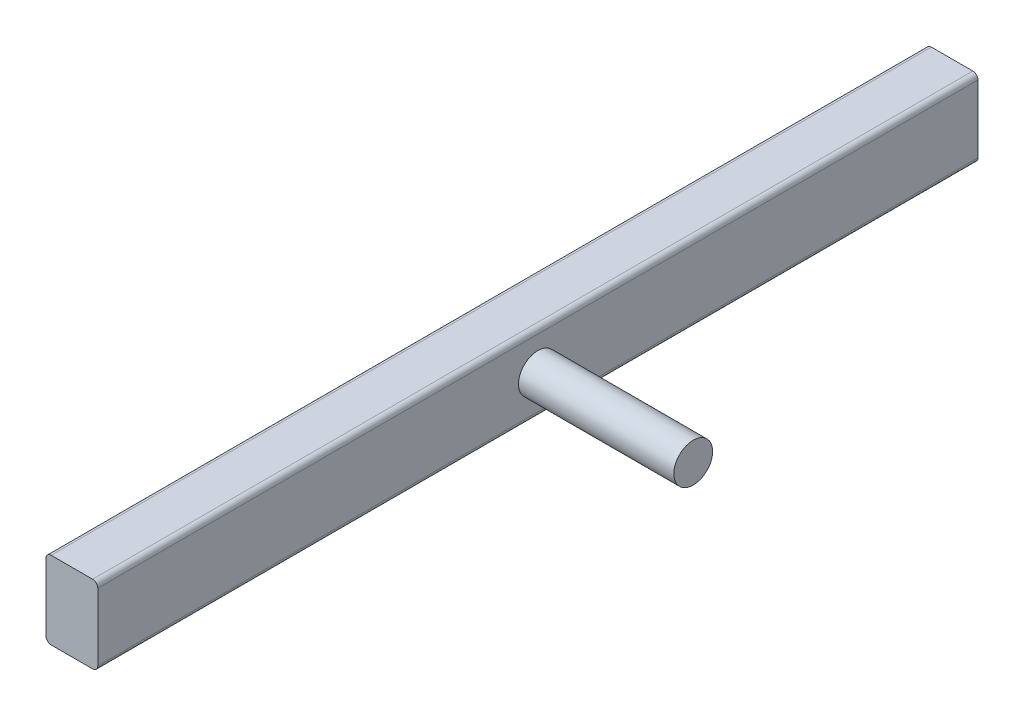
from build123d import *

# Parameters (mm, degrees)
SKETCH1_W           = 10
SKETCH1_H           = 15
BOSS_EXTRUDE1_DEPTH = 85
SKETCH2_R           = 3.75
BOSS_EXTRUDE2_DEPTH = 30
FILLET2_R           = 1


with BuildPart() as part:
    # Sketch1 → Boss-Extrude1 (new, symmetric)
    with BuildSketch(Plane.XY):
        Rectangle(SKETCH1_W, SKETCH1_H)
    extrude(amount=BOSS_EXTRUDE1_DEPTH, both=True)

    # Sketch2 → Boss-Extrude2 (add)
    with BuildSketch(Plane(origin=(5, 0, 0), x_dir=(0, 0, -1), z_dir=(1, 0, 0))):
        with Locations(Location((0, 0, 0), (0, 0, 270))):
            Circle(SKETCH2_R)
    extrude(amount=BOSS_EXTRUDE2_DEPTH)

    # Fillet2
    fillet2_edges = [part.edges().sort_by_distance(p)[0] for p in [
        (-5, 7.5, 0),
        (5, 7.5, 0),
        (5, -7.5, 0),
        (-5, -7.5, 0),
    ]]
    fillet(fillet2_edges, radius=FILLET2_R)


solid = part.part
